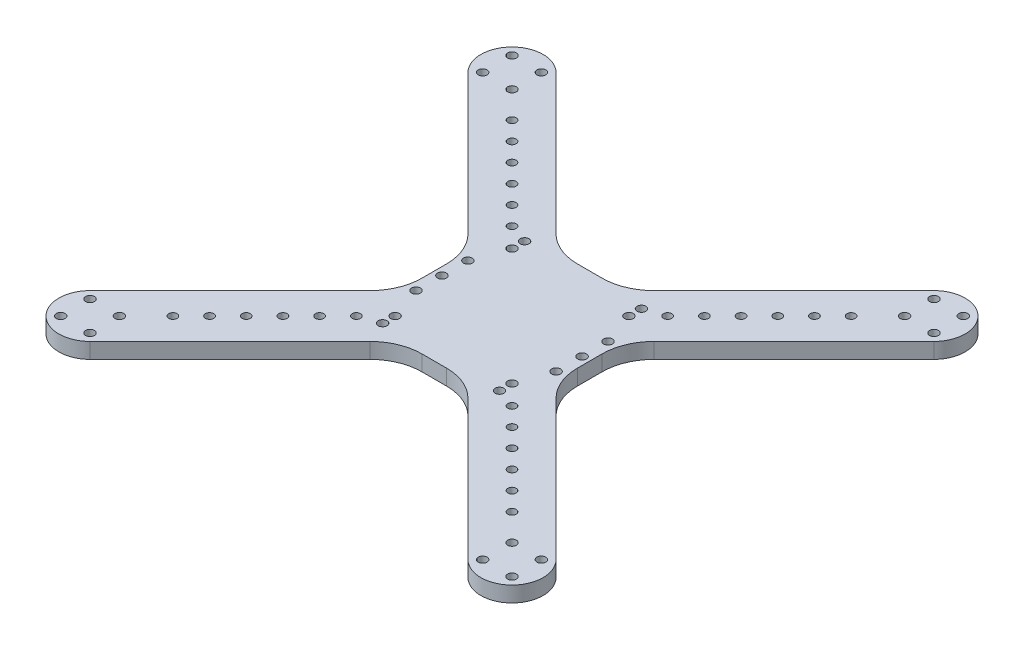
from build123d import *

# Parameters (mm, degrees)
BOSS_EXTRUDE1_DEPTH          = 6
FILLET1_R                    = 20
SKETCH2_R                    = 1.7
CUT_EXTRUDE1_DEPTH           = 133.106886392
CIRPATTERN1_COUNT            = 4
SKETCH3_R                    = 1.6
CUT_EXTRUDE2_DEPTH           = 133.106886392
LPATTERN1_COUNT              = 6
LPATTERN1_PITCH              = 10
CIRPATTERN2_COUNT            = 4
CIRPATTERN2_COPY_1_SKETCH_R  = 1.6
CIRPATTERN2_COPY_1_DEPTH     = 133.106886392
CIRPATTERN2_COPY_2_SKETCH_R  = 1.6
CIRPATTERN2_COPY_2_DEPTH     = 133.106886392
CIRPATTERN2_COPY_3_SKETCH_R  = 1.6
CIRPATTERN2_COPY_3_DEPTH     = 133.106886392
CIRPATTERN2_COPY_4_SKETCH_R  = 1.6
CIRPATTERN2_COPY_4_DEPTH     = 133.106886392
CIRPATTERN2_COPY_5_SKETCH_R  = 1.6
CIRPATTERN2_COPY_5_DEPTH     = 133.106886392
CIRPATTERN2_COPY_6_SKETCH_R  = 1.6
CIRPATTERN2_COPY_6_DEPTH     = 133.106886392
CIRPATTERN2_COPY_7_SKETCH_R  = 1.6
CIRPATTERN2_COPY_7_DEPTH     = 133.106886392
CIRPATTERN2_COPY_8_SKETCH_R  = 1.6
CIRPATTERN2_COPY_8_DEPTH     = 133.106886392
CIRPATTERN2_COPY_9_SKETCH_R  = 1.6
CIRPATTERN2_COPY_9_DEPTH     = 133.106886392
CIRPATTERN2_COPY_10_SKETCH_R = 1.6
CIRPATTERN2_COPY_10_DEPTH    = 133.106886392
CIRPATTERN2_COPY_11_SKETCH_R = 1.6
CIRPATTERN2_COPY_11_DEPTH    = 133.106886392
CIRPATTERN2_COPY_12_SKETCH_R = 1.6
CIRPATTERN2_COPY_12_DEPTH    = 133.106886392
CIRPATTERN2_COPY_13_SKETCH_R = 1.6
CIRPATTERN2_COPY_13_DEPTH    = 133.106886392
CIRPATTERN2_COPY_14_SKETCH_R = 1.6
CIRPATTERN2_COPY_14_DEPTH    = 133.106886392
CIRPATTERN2_COPY_15_SKETCH_R = 1.6
CIRPATTERN2_COPY_15_DEPTH    = 133.106886392
SKETCH4_R                    = 1.7
CUT_EXTRUDE3_DEPTH           = 133.106886392
CIRPATTERN3_COUNT            = 4
SKETCH5_R                    = 1.7
CUT_EXTRUDE4_DEPTH           = 133.106886392
SKETCH7_R                    = 1.7
CUT_EXTRUDE5_DEPTH           = 133.106886392
LPATTERN2_COUNT              = 2
LPATTERN2_PITCH              = 10
LPATTERN2_COL_COUNT          = 2
LPATTERN2_COL_PITCH          = 10
MIRROR2_COPY_1_SKETCH_R      = 1.7
MIRROR2_COPY_1_DEPTH         = 133.106886392
MIRROR2_COPY_2_SKETCH_R      = 1.7
MIRROR2_COPY_2_DEPTH         = 133.106886392


with BuildPart() as part:
    # Sketch1 → Boss-Extrude1 (new body)
    with BuildSketch(Plane(origin=(0, 0, 0), x_dir=(1, 0, 0), z_dir=(0, 1, 0))):
        with BuildLine():
            Line((-72.831998462, 89.802561211), (-13.029437252, 30))
            Line((-13.029437252, 30), (13.029437252, 30))
            Line((13.029437252, 30), (72.831998462, 89.802561211))
            ThreePointArc((72.831998462, 89.802561211), (89.802561211, 89.802561211), (89.802561211, 72.831998462))
            Line((89.802561211, 72.831998462), (30, 13.029437252))
            Line((30, 13.029437252), (30, -13.029437252))
            Line((30, -13.029437252), (89.802561211, -72.831998462))
            ThreePointArc((89.802561211, -72.831998462), (89.802561211, -89.802561211), (72.831998462, -89.802561211))
            Line((72.831998462, -89.802561211), (13.029437252, -30))
            Line((13.029437252, -30), (-13.029437252, -30))
            Line((-13.029437252, -30), (-72.831998462, -89.802561211))
            ThreePointArc((-72.831998462, -89.802561211), (-89.802561211, -89.802561211), (-89.802561211, -72.831998462))
            Line((-89.802561211, -72.831998462), (-30, -13.029437252))
            Line((-30, -13.029437252), (-30, 13.029437252))
            Line((-30, 13.029437252), (-89.802561211, 72.831998462))
            ThreePointArc((-89.802561211, 72.831998462), (-89.802561211, 89.802561211), (-72.831998462, 89.802561211))
        make_face()
    extrude(amount=BOSS_EXTRUDE1_DEPTH)

    # Fillet1
    fillet1_edges = [part.edges().sort_by_distance(p)[0] for p in [
        (-13.029437252, 3, -30),
        (13.029437252, 3, -30),
        (30, 3, -13.029437252),
        (30, 3, 13.029437252),
        (13.029437252, 3, 30),
        (-13.029437252, 3, 30),
        (-30, 3, 13.029437252),
        (-30, 3, -13.029437252),
    ]]
    fillet(fillet1_edges, radius=FILLET1_R)

    # Sketch2 → Cut-Extrude1 (cut, through all)
    with BuildSketch(Plane(origin=(0, 6, 0), x_dir=(1, 0, 0), z_dir=(0, 1, 0))):
        with Locations(Location((-22.525, -22.525, 0), (0, 0, 270))):
            Circle(SKETCH2_R)
    cut_extrude1 = extrude(amount=-CUT_EXTRUDE1_DEPTH, mode=Mode.SUBTRACT)

    # CirPattern1: Cut-Extrude1 ×4 about axis
    cirpattern1_axis = Axis((0, 0, 0), (0, 1, 0))
    for i in range(1, CIRPATTERN1_COUNT):
        add(cut_extrude1.rotate(cirpattern1_axis, i * 360 / CIRPATTERN1_COUNT), mode=Mode.SUBTRACT)

    # Sketch3 → Cut-Extrude2 (cut, through all)
    with BuildSketch(Plane(origin=(0, 6, 0), x_dir=(1, 0, 0), z_dir=(0, 1, 0))):
        with Locations(Location((-30, -30, 0), (0, 0, 270))):
            Circle(SKETCH3_R)
    cut_extrude2 = extrude(amount=-CUT_EXTRUDE2_DEPTH, mode=Mode.SUBTRACT)

    # LPattern1: Cut-Extrude2 ×6
    with Locations(*[Vector(-0.7071067811865467, 0, 0.7071067811865485) * (i * LPATTERN1_PITCH) for i in range(1, LPATTERN1_COUNT)]):
        add(cut_extrude2, mode=Mode.SUBTRACT)

    # CirPattern2: Cut-Extrude2 ×4 about axis
    cirpattern2_axis = Axis((0, 6.3, 0), (0, -1, 0))
    for i in range(1, CIRPATTERN2_COUNT):
        add(cut_extrude2.rotate(cirpattern2_axis, i * 360 / CIRPATTERN2_COUNT), mode=Mode.SUBTRACT)

    # CirPattern2 copy 1 sketch → CirPattern2 copy 1 (cut, through all)
    with BuildSketch(Plane(origin=(-7.071067812, 6, -7.071067812), x_dir=(0, 0, 1), z_dir=(0, 1, 0))):
        with Locations(Location((-30, -30, 0), (0, 0, 270))):
            Circle(CIRPATTERN2_COPY_1_SKETCH_R)
    extrude(amount=-CIRPATTERN2_COPY_1_DEPTH, mode=Mode.SUBTRACT)

    # CirPattern2 copy 2 sketch → CirPattern2 copy 2 (cut, through all)
    with BuildSketch(Plane(origin=(7.071067812, 6, -7.071067812), x_dir=(-1, 0, 0), z_dir=(0, 1, 0))):
        with Locations(Location((-30, -30, 0), (0, 0, 270))):
            Circle(CIRPATTERN2_COPY_2_SKETCH_R)
    extrude(amount=-CIRPATTERN2_COPY_2_DEPTH, mode=Mode.SUBTRACT)

    # CirPattern2 copy 3 sketch → CirPattern2 copy 3 (cut, through all)
    with BuildSketch(Plane(origin=(7.071067812, 6, 7.071067812), x_dir=(0, 0, -1), z_dir=(0, 1, 0))):
        with Locations(Location((-30, -30, 0), (0, 0, 270))):
            Circle(CIRPATTERN2_COPY_3_SKETCH_R)
    extrude(amount=-CIRPATTERN2_COPY_3_DEPTH, mode=Mode.SUBTRACT)

    # CirPattern2 copy 4 sketch → CirPattern2 copy 4 (cut, through all)
    with BuildSketch(Plane(origin=(-14.142135624, 6, -14.142135624), x_dir=(0, 0, 1), z_dir=(0, 1, 0))):
        with Locations(Location((-30, -30, 0), (0, 0, 270))):
            Circle(CIRPATTERN2_COPY_4_SKETCH_R)
    extrude(amount=-CIRPATTERN2_COPY_4_DEPTH, mode=Mode.SUBTRACT)

    # CirPattern2 copy 5 sketch → CirPattern2 copy 5 (cut, through all)
    with BuildSketch(Plane(origin=(14.142135624, 6, -14.142135624), x_dir=(-1, 0, 0), z_dir=(0, 1, 0))):
        with Locations(Location((-30, -30, 0), (0, 0, 270))):
            Circle(CIRPATTERN2_COPY_5_SKETCH_R)
    extrude(amount=-CIRPATTERN2_COPY_5_DEPTH, mode=Mode.SUBTRACT)

    # CirPattern2 copy 6 sketch → CirPattern2 copy 6 (cut, through all)
    with BuildSketch(Plane(origin=(14.142135624, 6, 14.142135624), x_dir=(0, 0, -1), z_dir=(0, 1, 0))):
        with Locations(Location((-30, -30, 0), (0, 0, 270))):
            Circle(CIRPATTERN2_COPY_6_SKETCH_R)
    extrude(amount=-CIRPATTERN2_COPY_6_DEPTH, mode=Mode.SUBTRACT)

    # CirPattern2 copy 7 sketch → CirPattern2 copy 7 (cut, through all)
    with BuildSketch(Plane(origin=(-21.213203436, 6, -21.213203436), x_dir=(0, 0, 1), z_dir=(0, 1, 0))):
        with Locations(Location((-30, -30, 0), (0, 0, 270))):
            Circle(CIRPATTERN2_COPY_7_SKETCH_R)
    extrude(amount=-CIRPATTERN2_COPY_7_DEPTH, mode=Mode.SUBTRACT)

    # CirPattern2 copy 8 sketch → CirPattern2 copy 8 (cut, through all)
    with BuildSketch(Plane(origin=(21.213203436, 6, -21.213203436), x_dir=(-1, 0, 0), z_dir=(0, 1, 0))):
        with Locations(Location((-30, -30, 0), (0, 0, 270))):
            Circle(CIRPATTERN2_COPY_8_SKETCH_R)
    extrude(amount=-CIRPATTERN2_COPY_8_DEPTH, mode=Mode.SUBTRACT)

    # CirPattern2 copy 9 sketch → CirPattern2 copy 9 (cut, through all)
    with BuildSketch(Plane(origin=(21.213203436, 6, 21.213203436), x_dir=(0, 0, -1), z_dir=(0, 1, 0))):
        with Locations(Location((-30, -30, 0), (0, 0, 270))):
            Circle(CIRPATTERN2_COPY_9_SKETCH_R)
    extrude(amount=-CIRPATTERN2_COPY_9_DEPTH, mode=Mode.SUBTRACT)

    # CirPattern2 copy 10 sketch → CirPattern2 copy 10 (cut, through all)
    with BuildSketch(Plane(origin=(-28.284271247, 6, -28.284271247), x_dir=(0, 0, 1), z_dir=(0, 1, 0))):
        with Locations(Location((-30, -30, 0), (0, 0, 270))):
            Circle(CIRPATTERN2_COPY_10_SKETCH_R)
    extrude(amount=-CIRPATTERN2_COPY_10_DEPTH, mode=Mode.SUBTRACT)

    # CirPattern2 copy 11 sketch → CirPattern2 copy 11 (cut, through all)
    with BuildSketch(Plane(origin=(28.284271247, 6, -28.284271247), x_dir=(-1, 0, 0), z_dir=(0, 1, 0))):
        with Locations(Location((-30, -30, 0), (0, 0, 270))):
            Circle(CIRPATTERN2_COPY_11_SKETCH_R)
    extrude(amount=-CIRPATTERN2_COPY_11_DEPTH, mode=Mode.SUBTRACT)

    # CirPattern2 copy 12 sketch → CirPattern2 copy 12 (cut, through all)
    with BuildSketch(Plane(origin=(28.284271247, 6, 28.284271247), x_dir=(0, 0, -1), z_dir=(0, 1, 0))):
        with Locations(Location((-30, -30, 0), (0, 0, 270))):
            Circle(CIRPATTERN2_COPY_12_SKETCH_R)
    extrude(amount=-CIRPATTERN2_COPY_12_DEPTH, mode=Mode.SUBTRACT)

    # CirPattern2 copy 13 sketch → CirPattern2 copy 13 (cut, through all)
    with BuildSketch(Plane(origin=(-35.355339059, 6, -35.355339059), x_dir=(0, 0, 1), z_dir=(0, 1, 0))):
        with Locations(Location((-30, -30, 0), (0, 0, 270))):
            Circle(CIRPATTERN2_COPY_13_SKETCH_R)
    extrude(amount=-CIRPATTERN2_COPY_13_DEPTH, mode=Mode.SUBTRACT)

    # CirPattern2 copy 14 sketch → CirPattern2 copy 14 (cut, through all)
    with BuildSketch(Plane(origin=(35.355339059, 6, -35.355339059), x_dir=(-1, 0, 0), z_dir=(0, 1, 0))):
        with Locations(Location((-30, -30, 0), (0, 0, 270))):
            Circle(CIRPATTERN2_COPY_14_SKETCH_R)
    extrude(amount=-CIRPATTERN2_COPY_14_DEPTH, mode=Mode.SUBTRACT)

    # CirPattern2 copy 15 sketch → CirPattern2 copy 15 (cut, through all)
    with BuildSketch(Plane(origin=(35.355339059, 6, 35.355339059), x_dir=(0, 0, -1), z_dir=(0, 1, 0))):
        with Locations(Location((-30, -30, 0), (0, 0, 270))):
            Circle(CIRPATTERN2_COPY_15_SKETCH_R)
    extrude(amount=-CIRPATTERN2_COPY_15_DEPTH, mode=Mode.SUBTRACT)

    # Sketch4 → Cut-Extrude3 (cut, through all)
    with BuildSketch(Plane(origin=(0, 6, 0), x_dir=(1, 0, 0), z_dir=(0, 1, 0))):
        with Locations(Location((-86.974134086, -86.974134086, 0), (0, 0, 270))):
            Circle(SKETCH4_R)
        with Locations(Location((-86.974134086, -75.660425587, 0), (0, 0, 270))):
            Circle(SKETCH4_R)
        with Locations(Location((-75.660425587, -75.660425587, 0), (0, 0, 270))):
            Circle(SKETCH4_R)
        with Locations(Location((-75.660425587, -86.974134086, 0), (0, 0, 270))):
            Circle(SKETCH4_R)
    cut_extrude3 = extrude(amount=-CUT_EXTRUDE3_DEPTH, mode=Mode.SUBTRACT)

    # CirPattern3: Cut-Extrude3 ×4 about axis
    cirpattern3_axis = Axis((0, 0, 0), (0, 1, 0))
    for i in range(1, CIRPATTERN3_COUNT):
        add(cut_extrude3.rotate(cirpattern3_axis, i * 360 / CIRPATTERN3_COUNT), mode=Mode.SUBTRACT)

    # Sketch5 → Cut-Extrude4 (cut, through all)
    with BuildSketch(Plane(origin=(0, 6, 0), x_dir=(1, 0, 0), z_dir=(0, 1, 0))):
        with Locations(Location((-22.525, 27.375, 0), (0, 0, 270))):
            Circle(SKETCH5_R)
        with Locations(Location((-22.525, -27.35, 0), (0, 0, 270))):
            Circle(SKETCH5_R)
    cut_extrude4 = extrude(amount=-CUT_EXTRUDE4_DEPTH, mode=Mode.SUBTRACT)

    # Mirror1: Cut-Extrude4 across plane
    add(cut_extrude4.mirror(Plane(origin=(0, 0, 0), x_dir=(0, 0, 1), z_dir=(1, 0, 0))), mode=Mode.SUBTRACT)

    # Sketch7 → Cut-Extrude5 (cut, through all)
    with BuildSketch(Plane(origin=(0, 6, 0), x_dir=(1, 0, 0), z_dir=(0, 1, 0))):
        with Locations(Location((-27, 0, 0), (0, 0, 270))):
            Circle(SKETCH7_R)
    cut_extrude5 = extrude(amount=-CUT_EXTRUDE5_DEPTH, mode=Mode.SUBTRACT)

    # LPattern2: Cut-Extrude5 ×2
    with Locations(*[(0, 0, i * LPATTERN2_PITCH) for i in range(1, LPATTERN2_COUNT)]):
        add(cut_extrude5, mode=Mode.SUBTRACT)

    # LPattern2 col: Cut-Extrude5 ×2
    with Locations(*[(0, 0, -i * LPATTERN2_COL_PITCH) for i in range(1, LPATTERN2_COL_COUNT)]):
        add(cut_extrude5, mode=Mode.SUBTRACT)

    # Mirror2: Cut-Extrude5 across plane
    add(cut_extrude5.mirror(Plane(origin=(0, 0, 0), x_dir=(0, 0, 1), z_dir=(1, 0, 0))), mode=Mode.SUBTRACT)

    # Mirror2 copy 1 sketch → Mirror2 copy 1 (cut, through all)
    with BuildSketch(Plane(origin=(0, 6, 10), x_dir=(-1, 0, 0), z_dir=(0, 1, 0))):
        with Locations((-27, 0)):
            Circle(MIRROR2_COPY_1_SKETCH_R)
    extrude(amount=-MIRROR2_COPY_1_DEPTH, mode=Mode.SUBTRACT)

    # Mirror2 copy 2 sketch → Mirror2 copy 2 (cut, through all)
    with BuildSketch(Plane(origin=(0, 6, -10), x_dir=(-1, 0, 0), z_dir=(0, 1, 0))):
        with Locations((-27, 0)):
            Circle(MIRROR2_COPY_2_SKETCH_R)
    extrude(amount=-MIRROR2_COPY_2_DEPTH, mode=Mode.SUBTRACT)


solid = part.part
